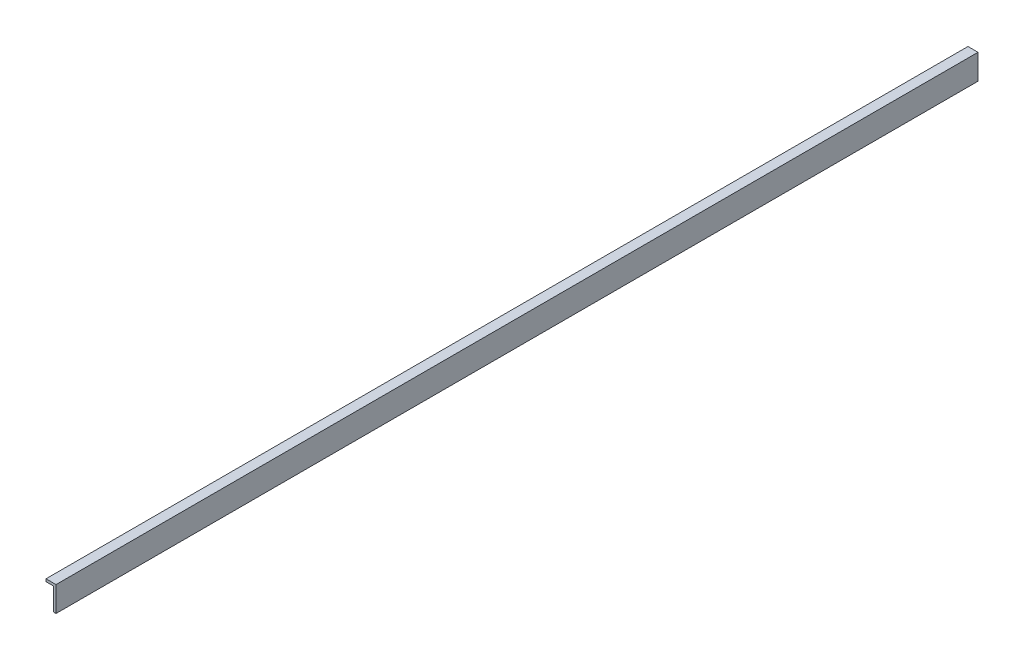
from build123d import *

# Parameters (mm, degrees)
STORE_KASET_L_RAF_2_SAG_1_START = -20
STORE_KASET_L_RAF_2_SAG_1_DEPTH = 735.5


with BuildPart() as part:
    # Sketch1 → STORE_kaset_L_raf_2_sag_1 (new body)
    with BuildSketch(Plane.XY.offset(STORE_KASET_L_RAF_2_SAG_1_START)):
        Polygon((353.5, 404.5), (355.5, 404.5), (355.5, 424.5), (347.5, 424.5), (347.5, 422.5), (353.5, 422.5), align=None)
    extrude(amount=-STORE_KASET_L_RAF_2_SAG_1_DEPTH)


solid = part.part
